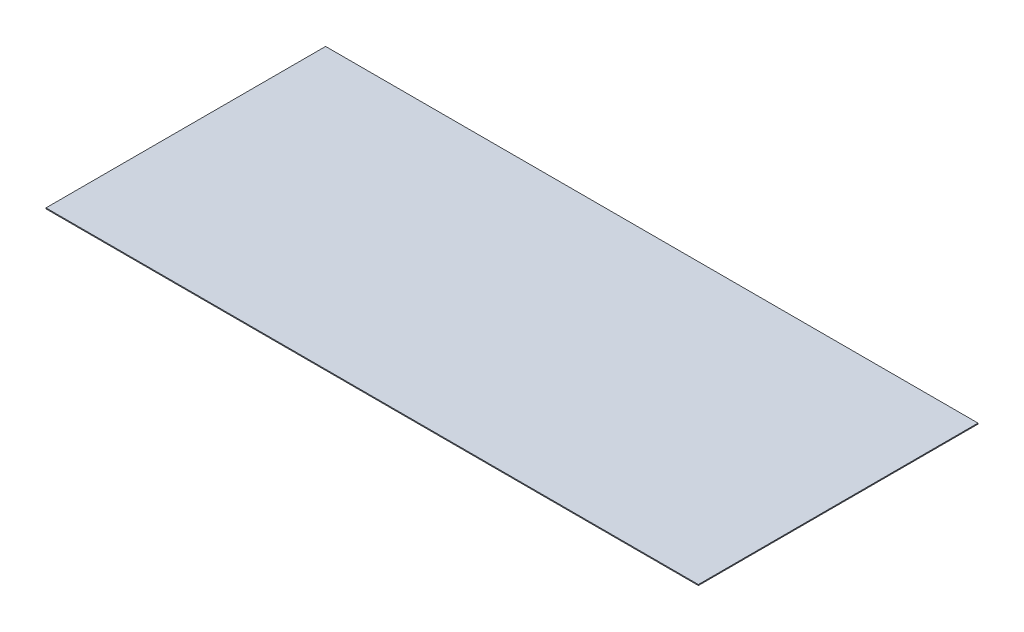
from build123d import *

# Parameters (mm, degrees)
SKETCH_2_W      = 14000
SKETCH_2_H      = 6000
EXTRUDE_1_DEPTH = 20


with BuildPart() as part:
    # 草图2 → 凸台-拉伸1 (new body)
    with BuildSketch(Plane(origin=(0, 0, 0), x_dir=(1, 0, 0), z_dir=(0, 1, 0))):
        Rectangle(SKETCH_2_W, SKETCH_2_H)
    extrude(amount=-EXTRUDE_1_DEPTH)


solid = part.part
